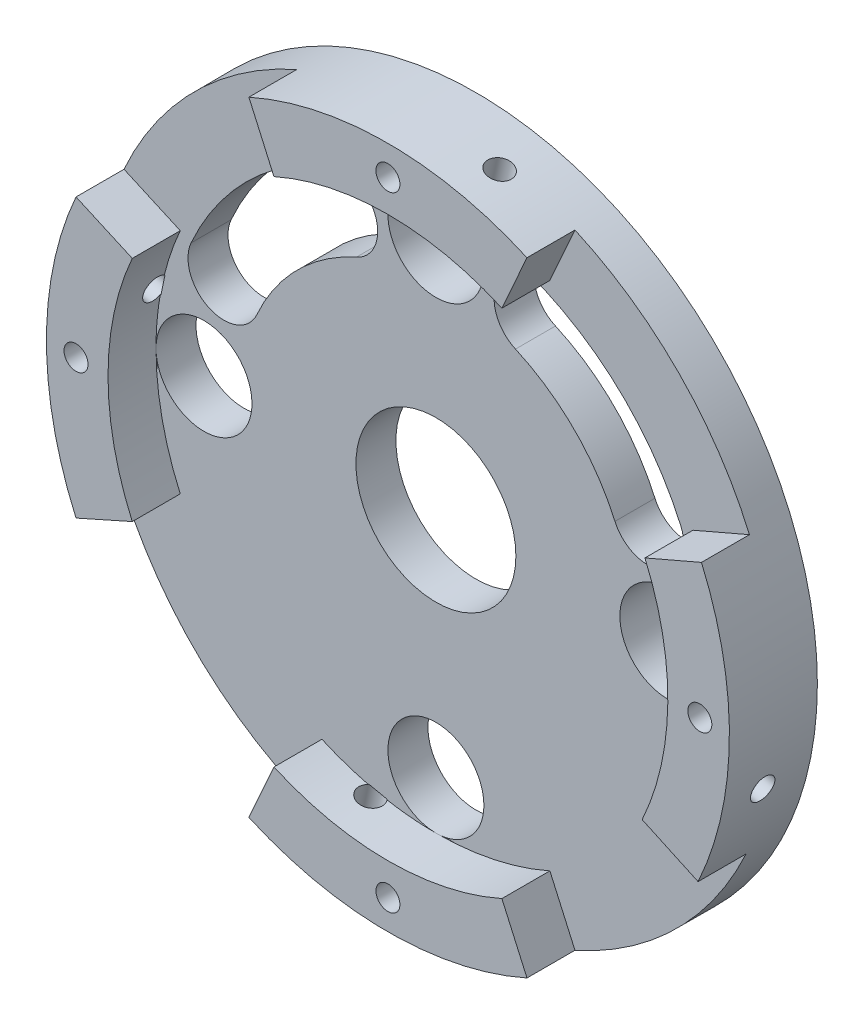
from build123d import *

# Parameters (mm, degrees)
SKETCH_1_R               = 42.7
EXTRUDE_1_DEPTH          = 5
SKETCH_2_R               = 42.7
SKETCH_2_R_2             = 35
EXTRUDE_2_DEPTH          = 6
SKETCH_3_R               = 1.5
CUT_EXTRUDE_1_DEPTH      = 11
SKETCH_4_R               = 6
CUT_EXTRUDE_2_DEPTH      = 11
CUT_EXTRUDE_3_DEPTH      = 11
SKETCH_6_R               = 10
CUT_EXTRUDE_4_DEPTH      = 11
CUT_EXTRUDE_START        = -6
CUT_EXTRUDE_5_DEPTH      = 6
CUT_EXTRUDE_6_DEPTH      = 50
CUT_EXTRUDE_6_DEPTH_BACK = 50
SKETCH_9_R               = 1.5
CUT_EXTRUDE_7_DEPTH      = 50
CUT_EXTRUDE_7_DEPTH_BACK = 50
SKETCH_10_R              = 1.5
EXTRUDE_12_DEPTH         = 36
EXTRUDE_12_DEPTH_BACK    = 36
SKETCH_13_R              = 1.5
EXTRUDE_13_DEPTH         = 36
EXTRUDE_13_DEPTH_BACK    = 36
SKETCH_14_R              = 1.5
SKETCH_15_R              = 35
CUT_EXTRUDE_8_DEPTH      = 6
SKETCH_16_R              = 10
CUT_EXTRUDE_9_DEPTH      = 6
SKETCH_17_R              = 1.5
CUT_EXTRUDE_11_DEPTH     = 1.1
CUT_EXTRUDE_START_2      = -1.1
SKETCH_18_R              = 1.5
CUT_EXTRUDE_12_DEPTH     = 1.1
SKETCH_19_R              = 1.5
CUT_EXTRUDE_13_DEPTH     = 1.1
SKETCH_20_R              = 1.5
CUT_EXTRUDE_14_DEPTH     = 1.1
SKETCH_21_R              = 6
CUT_EXTRUDE_15_DEPTH     = 5


with BuildPart() as part:
    # 草图1 → 凸台-拉伸1 (new body)
    with BuildSketch(Plane.XY):
        Circle(SKETCH_1_R)
    extrude(amount=EXTRUDE_1_DEPTH)

    # 草图2 → 凸台-拉伸2 (add)
    with BuildSketch(Plane.XY.offset(5)):
        Circle(SKETCH_2_R)
        Circle(SKETCH_2_R_2, mode=Mode.SUBTRACT)
    extrude(amount=EXTRUDE_2_DEPTH)

    # 草图3 → 切除-拉伸1 (cut)
    with BuildSketch(Plane.XY.offset(11)):
        with Locations((0, 39)):
            Circle(SKETCH_3_R)
        with Locations((39, 0)):
            Circle(SKETCH_3_R)
        with Locations((0, -39)):
            Circle(SKETCH_3_R)
        with Locations((-39, 0)):
            Circle(SKETCH_3_R)
    extrude(amount=-CUT_EXTRUDE_1_DEPTH, mode=Mode.SUBTRACT)

    # 草图4 → 切除-拉伸2 (cut)
    with BuildSketch(Plane.XY.offset(11)):
        with Locations((29, 0)):
            Circle(SKETCH_4_R)
        with Locations((0, 29)):
            Circle(SKETCH_4_R)
        with Locations((0, -29)):
            Circle(SKETCH_4_R)
        with Locations((-29, 0)):
            Circle(SKETCH_4_R)
    extrude(amount=-CUT_EXTRUDE_2_DEPTH, mode=Mode.SUBTRACT)

    # 草图5 → 切除-拉伸3 (cut)
    with BuildSketch(Plane.XY.offset(5)):
        with BuildLine():
            ThreePointArc((9.951409146, 22.387931034), (17.324116139, 17.324116139), (22.387931034, 9.951409146))
            ThreePointArc((22.387931034, 9.951409146), (28.327809843, 7.667150024), (30.612068966, 13.607028833))
            ThreePointArc((30.612068966, 13.607028833), (23.68807717, 23.68807717), (13.607028833, 30.612068966))
            ThreePointArc((13.607028833, 30.612068966), (7.667150024, 28.327809843), (9.951409146, 22.387931034))
        make_face()
        with BuildLine():
            ThreePointArc((-9.951409146, 22.387931034), (-7.667150024, 28.327809843), (-13.607028833, 30.612068966))
            ThreePointArc((-13.607028833, 30.612068966), (-23.68807717, 23.68807717), (-30.612068966, 13.607028833))
            ThreePointArc((-30.612068966, 13.607028833), (-28.327809843, 7.667150024), (-22.387931034, 9.951409146))
            ThreePointArc((-22.387931034, 9.951409146), (-17.324116139, 17.324116139), (-9.951409146, 22.387931034))
        make_face()
    extrude(amount=-CUT_EXTRUDE_3_DEPTH, mode=Mode.SUBTRACT)

    # 草图6 → 切除-拉伸4 (cut)
    with BuildSketch(Plane.XY.offset(5)):
        Circle(SKETCH_6_R)
    extrude(amount=-CUT_EXTRUDE_4_DEPTH, mode=Mode.SUBTRACT)

    # 草图7 → 切除-拉伸5 (cut)
    with BuildSketch(Plane.XY.offset(11).offset(CUT_EXTRUDE_START)):
        with BuildLine():
            ThreePointArc((39.206540603, 16.915589672), (30.374710616, 30.011113858), (17.386489007, 39))
            Line((17.386489007, 39), (14.251220498, 31.967213115))
            ThreePointArc((14.251220498, 31.967213115), (24.897303783, 24.599273654), (32.136508691, 13.865237436))
            Line((32.136508691, 13.865237436), (39.206540603, 16.915589672))
        make_face()
        with BuildLine():
            Line((-14.251220498, 31.967213115), (-17.386489007, 39))
            ThreePointArc((-17.386489007, 39), (-30.193459557, 30.193459557), (-39, 17.386489007))
            Line((-39, 17.386489007), (-31.967213115, 14.251220498))
            ThreePointArc((-31.967213115, 14.251220498), (-24.748737342, 24.748737342), (-14.251220498, 31.967213115))
        make_face()
        with BuildLine():
            Line((-31.967213115, -14.251220498), (-39, -17.386489007))
            ThreePointArc((-39, -17.386489007), (-30.193459557, -30.193459557), (-17.386489007, -39))
            Line((-17.386489007, -39), (-14.251220498, -31.967213115))
            ThreePointArc((-14.251220498, -31.967213115), (-24.748737342, -24.748737342), (-31.967213115, -14.251220498))
        make_face()
        with BuildLine():
            ThreePointArc((17.386489007, -39), (30.006036038, -30.379726814), (38.78183243, -17.867833483))
            Line((38.78183243, -17.867833483), (31.788387238, -14.64576515))
            ThreePointArc((31.788387238, -14.64576515), (24.595111506, -24.901415422), (14.251220498, -31.967213115))
            Line((14.251220498, -31.967213115), (17.386489007, -39))
        make_face()
    extrude(amount=CUT_EXTRUDE_5_DEPTH, mode=Mode.SUBTRACT)

    # 草图9 → 切除-拉伸6 (cut, two sides: drawn at the far end of the back side and taken through both)
    with BuildSketch(Plane(origin=(0, 0, 0), x_dir=(0, 0, -1), z_dir=(-0.2079116908177632, -0.9781476007338048, 0)).offset(-CUT_EXTRUDE_6_DEPTH_BACK)):
        with Locations((-5.905553742, 0)):
            Circle(SKETCH_9_R)
    extrude(amount=CUT_EXTRUDE_6_DEPTH + CUT_EXTRUDE_6_DEPTH_BACK, mode=Mode.SUBTRACT)

    # 草图10 → 切除-拉伸7 (cut, two sides: drawn at the far end of the back side and taken through both)
    with BuildSketch(Plane(origin=(0, 0, 0), x_dir=(0, 0, -1), z_dir=(0.9781476007338056, -0.2079116908177598, 0)).offset(-CUT_EXTRUDE_7_DEPTH_BACK)):
        with Locations((-5.905553742, 0)):
            Circle(SKETCH_10_R)
    extrude(amount=CUT_EXTRUDE_7_DEPTH + CUT_EXTRUDE_7_DEPTH_BACK, mode=Mode.SUBTRACT)

    # 草图13 → 凸台-拉伸12 (add, two sides: drawn at the far end of the back side and taken through both)
    with BuildSketch(Plane(origin=(0, 0, 0), x_dir=(0, 0, -1), z_dir=(-0.2079116908177632, -0.9781476007338048, 0)).offset(-EXTRUDE_12_DEPTH_BACK)):
        with Locations((-5.905553742, 0)):
            Circle(SKETCH_13_R)
    extrude(amount=EXTRUDE_12_DEPTH + EXTRUDE_12_DEPTH_BACK)

    # 草图14 → 凸台-拉伸13 (add, two sides: drawn at the far end of the back side and taken through both)
    with BuildSketch(Plane(origin=(0, 0, 0), x_dir=(0, 0, -1), z_dir=(0.9781476007338056, -0.2079116908177598, 0)).offset(-EXTRUDE_13_DEPTH_BACK)):
        with Locations((-5.905553742, 0)):
            Circle(SKETCH_14_R)
    extrude(amount=EXTRUDE_13_DEPTH + EXTRUDE_13_DEPTH_BACK)

    # 草图15 → 切除-拉伸8 (cut)
    with BuildSketch(Plane.XY.offset(11).offset(CUT_EXTRUDE_START)):
        Circle(SKETCH_15_R)
    extrude(amount=CUT_EXTRUDE_8_DEPTH, mode=Mode.SUBTRACT)

    # 草图16 → 切除-拉伸9 (cut)
    with BuildSketch(Plane.XY.offset(5)):
        Circle(SKETCH_16_R)
    extrude(amount=-CUT_EXTRUDE_9_DEPTH, mode=Mode.SUBTRACT)

    # 草图17 → 切除-拉伸11 (cut)
    with BuildSketch(Plane(origin=(35.213313626, -7.484820869, 0), x_dir=(0, 0, -1), z_dir=(0.9781476007338056, -0.2079116908177598, 0))):
        with Locations((-5.905553742, 0)):
            Circle(SKETCH_17_R)
    extrude(amount=-CUT_EXTRUDE_11_DEPTH, mode=Mode.SUBTRACT)

    # 草图18 → 切除-拉伸12 (cut)
    with BuildSketch(Plane(origin=(-35.213313626, 7.484820869, 0), x_dir=(0, 0, 1), z_dir=(-0.9781476007338056, 0.2079116908177598, 0)).offset(CUT_EXTRUDE_START_2)):
        with Locations((5.905553742, 0)):
            Circle(SKETCH_18_R)
    extrude(amount=CUT_EXTRUDE_12_DEPTH, mode=Mode.SUBTRACT)

    # 草图19 → 切除-拉伸13 (cut)
    with BuildSketch(Plane(origin=(7.484820869, 35.213313626, 0), x_dir=(0.9781476007338048, -0.2079116908177632, 0), z_dir=(0.2079116908177632, 0.9781476007338048, 0))):
        with Locations((0, -5.905553742)):
            Circle(SKETCH_19_R)
    extrude(amount=-CUT_EXTRUDE_13_DEPTH, mode=Mode.SUBTRACT)

    # 草图20 → 切除-拉伸14 (cut)
    with BuildSketch(Plane(origin=(-7.484820869, -35.213313626, 0), x_dir=(0.9781476007338048, -0.2079116908177632, 0), z_dir=(-0.2079116908177632, -0.9781476007338048, 0)).offset(CUT_EXTRUDE_START_2)):
        with Locations((0, 5.905553742)):
            Circle(SKETCH_20_R)
    extrude(amount=CUT_EXTRUDE_14_DEPTH, mode=Mode.SUBTRACT)

    # 草图21 → 切除-拉伸15 (cut)
    with BuildSketch(Plane.XY.offset(5)):
        with Locations((0, 29)):
            Circle(SKETCH_21_R)
        with Locations((-29, 0)):
            Circle(SKETCH_21_R)
        with Locations((0, -29)):
            Circle(SKETCH_21_R)
        with Locations((29, 0)):
            Circle(SKETCH_21_R)
    extrude(amount=-CUT_EXTRUDE_15_DEPTH, mode=Mode.SUBTRACT)


solid = part.part
